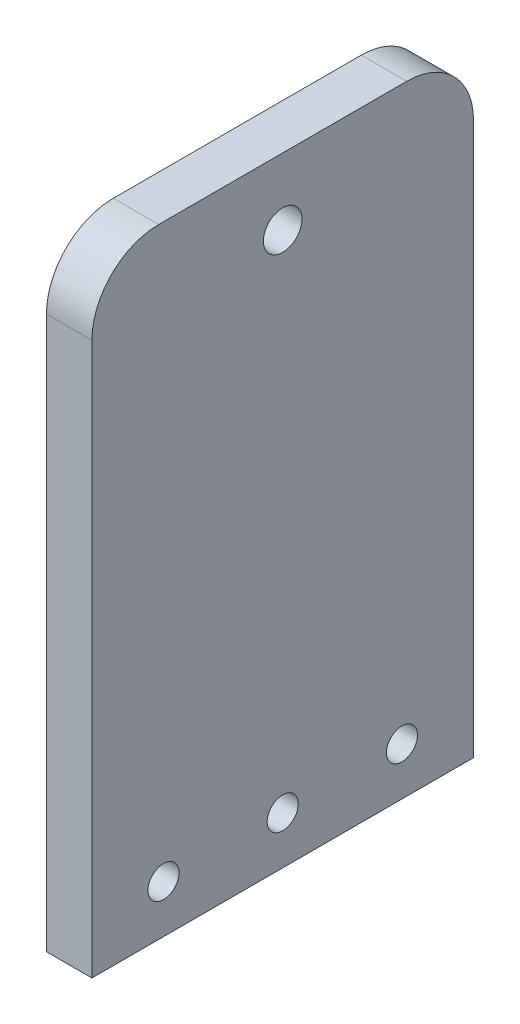
from build123d import *

# Parameters (mm, degrees)
BOSS_EXTRUDE1_DEPTH   = 4.7625
F_4_CLEARANCE_HOLE1_D = 3.2639
SKETCH10_R            = 2.025
CUT_EXTRUDE1_DEPTH    = 10


with BuildPart() as part:
    # Sketch1 → Boss-Extrude1 (new body)
    with BuildSketch(Plane(origin=(0, 0, 0), x_dir=(0, 0, -1), z_dir=(1, 0, 0))):
        with BuildLine():
            Line((0, 57.9), (0, 0))
            Line((0, 0), (40, 0))
            Line((40, 0), (40, 57.9))
            ThreePointArc((40, 57.9), (37.949747468, 62.849747468), (33, 64.9))
            Line((33, 64.9), (7, 64.9))
            ThreePointArc((7, 64.9), (2.050252532, 62.849747468), (0, 57.9))
        make_face()
    extrude(amount=BOSS_EXTRUDE1_DEPTH)

    # #4 Clearance Hole1 (through all)
    with Locations(Plane(origin=(4.7625, 0, 0), x_dir=(0, 0, -1), z_dir=(1, 0, 0))):
        with Locations((7.5, 5), (20, 5), (32.5, 5)):
            Hole(F_4_CLEARANCE_HOLE1_D / 2)

    # Sketch10 → Cut-Extrude1 (cut)
    with BuildSketch(Plane(origin=(4.7625, 0, 0), x_dir=(0, 0, -1), z_dir=(1, 0, 0))):
        with Locations((20, 57.9)):
            Circle(SKETCH10_R)
    extrude(amount=-CUT_EXTRUDE1_DEPTH, mode=Mode.SUBTRACT)


solid = part.part
